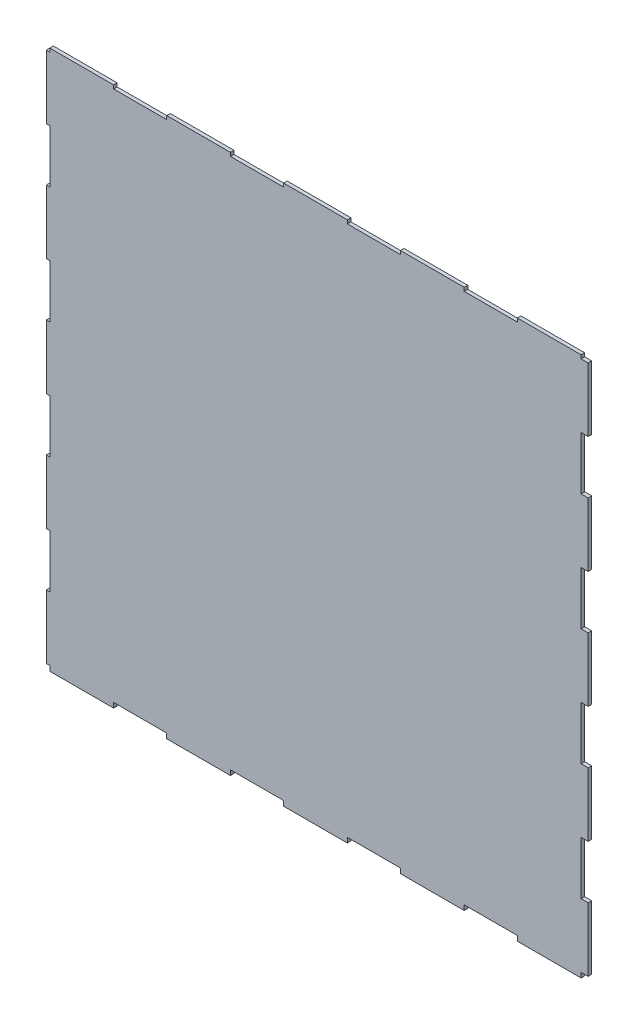
from build123d import *

# Parameters (mm, degrees)
SKETCH1_W           = 152.4
SKETCH1_H           = 152.4
SKETCH1_W_2         = 127
SKETCH1_H_2         = 127
SKETCH1_W_3         = 18.288
SKETCH1_H_3         = 1.016
SKETCH1_W_4         = 2.032
SKETCH1_H_4         = 18.288
SKETCH1_W_5         = 1.016
SKETCH1_H_5         = 1.415312077
BOSS_EXTRUDE1_DEPTH = 1.016


with BuildPart() as part:
    # Sketch1 → Boss-Extrude1 (new body)
    # profile 1 of 22: a face of its own
    with BuildSketch(Plane.XY):
        with Locations((-7.216666869, 26.486776145)):
            Rectangle(SKETCH1_W, SKETCH1_H)
        with Locations((-7.216666869, 26.486776145)):
            Rectangle(SKETCH1_W_2, SKETCH1_H_2, mode=Mode.SUBTRACT)
    # profile 2 of 22: a face of its own
    with BuildSketch(Plane.XY):
        with Locations((59.839333131, 103.194776145)):
            Rectangle(SKETCH1_W_3, SKETCH1_H_3)
    # profile 3 of 22: a face of its own
    with BuildSketch(Plane.XY):
        with Locations((69.999333131, 93.542776145)):
            Rectangle(SKETCH1_W_4, SKETCH1_H_4)
    # profile 4 of 22: a face of its own
    with BuildSketch(Plane.XY):
        with Locations((26.311333131, 103.194776145)):
            Rectangle(SKETCH1_W_3, SKETCH1_H_3)
    # profile 5 of 22: a face of its own
    with BuildSketch(Plane.XY):
        with Locations((-7.216666869, 103.194776145)):
            Rectangle(SKETCH1_W_3, SKETCH1_H_3)
    # profile 6 of 22: a face of its own
    with BuildSketch(Plane.XY):
        with Locations((-40.744666869, 103.194776145)):
            Rectangle(SKETCH1_W_3, SKETCH1_H_3)
    # profile 7 of 22: a face of its own
    with BuildSketch(Plane.XY):
        with Locations((-74.272666869, 103.194776145)):
            Rectangle(SKETCH1_W_3, SKETCH1_H_3)
    # profile 8 of 22: a face of its own
    with BuildSketch(Plane.XY):
        with Locations((-83.924666869, 93.542776145)):
            Rectangle(SKETCH1_W_5, SKETCH1_H_4)
    # profile 9 of 22: a face of its own
    with BuildSketch(Plane.XY):
        with Locations((-83.924666869, 60.014776145)):
            Rectangle(SKETCH1_W_5, SKETCH1_H_4)
    # profile 10 of 22: a face of its own
    with BuildSketch(Plane.XY):
        with Locations((-83.924666869, -40.569223855)):
            Rectangle(SKETCH1_W_5, SKETCH1_H_4)
    # profile 11 of 22: a face of its own
    with BuildSketch(Plane.XY):
        with Locations((-74.272666869, -50.420879894)):
            Rectangle(SKETCH1_W_3, SKETCH1_H_5)
    # profile 12 of 22: a face of its own
    with BuildSketch(Plane.XY):
        with Locations((-40.744666869, -50.420879894)):
            Rectangle(SKETCH1_W_3, SKETCH1_H_5)
    # profile 13 of 22: a face of its own
    with BuildSketch(Plane.XY):
        with Locations((26.311333131, -50.420879894)):
            Rectangle(SKETCH1_W_3, SKETCH1_H_5)
    # profile 14 of 22: a face of its own
    with BuildSketch(Plane.XY):
        with Locations((-7.216666869, -50.420879894)):
            Rectangle(SKETCH1_W_3, SKETCH1_H_5)
    # profile 15 of 22: a face of its own
    with BuildSketch(Plane.XY):
        with Locations((59.839333131, -50.420879894)):
            Rectangle(SKETCH1_W_3, SKETCH1_H_5)
    # profile 16 of 22: a face of its own
    with BuildSketch(Plane.XY):
        with Locations((69.999333131, -40.569223855)):
            Rectangle(SKETCH1_W_4, SKETCH1_H_4)
    # profile 17 of 22: a face of its own
    with BuildSketch(Plane.XY):
        with Locations((69.999333131, -7.041223855)):
            Rectangle(SKETCH1_W_4, SKETCH1_H_4)
    # profile 18 of 22: a face of its own
    with BuildSketch(Plane.XY):
        with Locations((69.999333131, 26.486776145)):
            Rectangle(SKETCH1_W_4, SKETCH1_H_4)
    # profile 19 of 22: a face of its own
    with BuildSketch(Plane.XY):
        with Locations((69.999333131, 60.014776145)):
            Rectangle(SKETCH1_W_4, SKETCH1_H_4)
    # profile 20 of 22: a face of its own
    with BuildSketch(Plane.XY):
        with Locations((-7.216666869, 26.486776145)):
            Rectangle(SKETCH1_W_2, SKETCH1_H_2)
    # profile 21 of 22: a face of its own
    with BuildSketch(Plane.XY):
        with Locations((-83.924666869, 26.486776145)):
            Rectangle(SKETCH1_W_5, SKETCH1_H_4)
    # profile 22 of 22: a face of its own
    with BuildSketch(Plane.XY):
        with Locations((-83.924666869, -7.041223855)):
            Rectangle(SKETCH1_W_5, SKETCH1_H_4)
    extrude(amount=BOSS_EXTRUDE1_DEPTH)


solid = part.part
